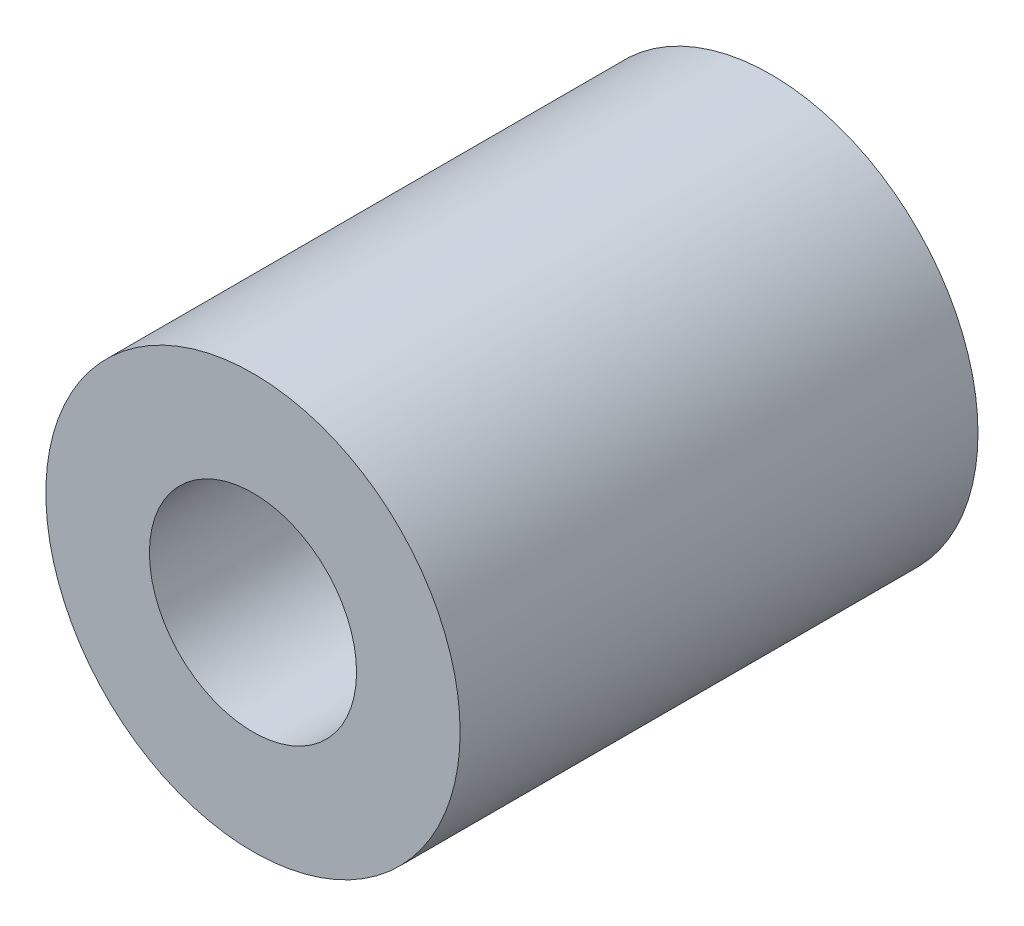
from build123d import *

# Parameters (mm, degrees)
SKETCH_1_R      = 2
SKETCH_1_R_2    = 1
EXTRUDE_1_DEPTH = 5


with BuildPart() as part:
    # 草图1 → 凸台-拉伸1 (new body)
    with BuildSketch(Plane.XY):
        Circle(SKETCH_1_R)
        Circle(SKETCH_1_R_2, mode=Mode.SUBTRACT)
    extrude(amount=EXTRUDE_1_DEPTH)


solid = part.part
